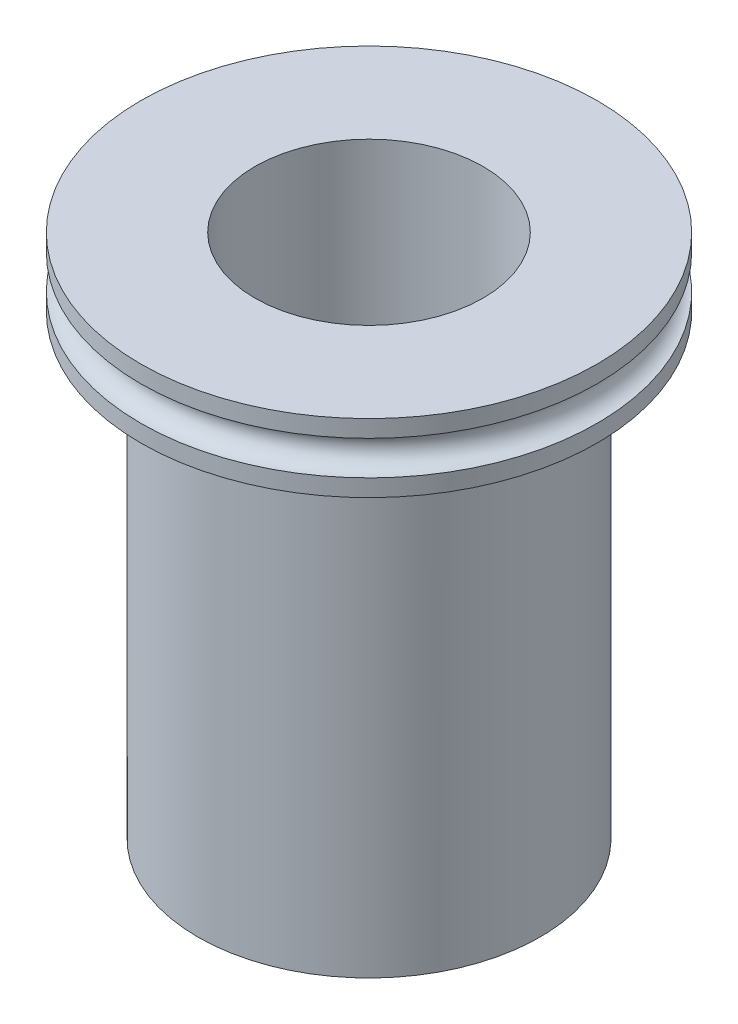
from build123d import *

# Parameters (mm, degrees)
CROQUIS1_R              = 10
SALIENTE_EXTRUIR1_DEPTH = 3
CROQUIS2_R              = 0.75
CROQUIS4_R              = 7.5
SALIENTE_EXTRUIR2_DEPTH = 20
CROQUIS3_R              = 5
CORTAR_EXTRUIR1_DEPTH   = 28


with BuildPart() as part:
    # Croquis1 → Saliente-Extruir1 (new body)
    with BuildSketch(Plane(origin=(0, 0, 0), x_dir=(1, 0, 0), z_dir=(0, 1, 0))):
        with Locations(Location((0, 0, 0), (0, 0, 270))):
            Circle(CROQUIS1_R)
    extrude(amount=SALIENTE_EXTRUIR1_DEPTH)

    # Croquis2 → Cortar-Revolución1 (revolve, cut)
    with BuildSketch(Plane(origin=(0, 0, 0), x_dir=(0, 0, -1), z_dir=(1, 0, 0)), mode=Mode.PRIVATE) as cortar_revoluci_n1_sk:
        with Locations((10, 1.5)):
            Circle(CROQUIS2_R)
    revolve(cortar_revoluci_n1_sk.sketch.rotate(Axis((0, 3, 0), (0, -1, 0)), 180), axis=Axis((0, 3, 0), (0, -1, 0)), mode=Mode.SUBTRACT)

    # Croquis4 → Saliente-Extruir2 (add)
    with BuildSketch(Plane.XZ):
        with Locations(Location((0, 0, 0), (0, 0, 90))):
            Circle(CROQUIS4_R)
    extrude(amount=SALIENTE_EXTRUIR2_DEPTH)

    # Croquis3 → Cortar-Extruir1 (cut, through all)
    with BuildSketch(Plane(origin=(0, 3, 0), x_dir=(1, 0, 0), z_dir=(0, 1, 0))):
        with Locations(Location((0, 0, 0), (0, 0, 270))):
            Circle(CROQUIS3_R)
    extrude(amount=-CORTAR_EXTRUIR1_DEPTH, mode=Mode.SUBTRACT)


solid = part.part
